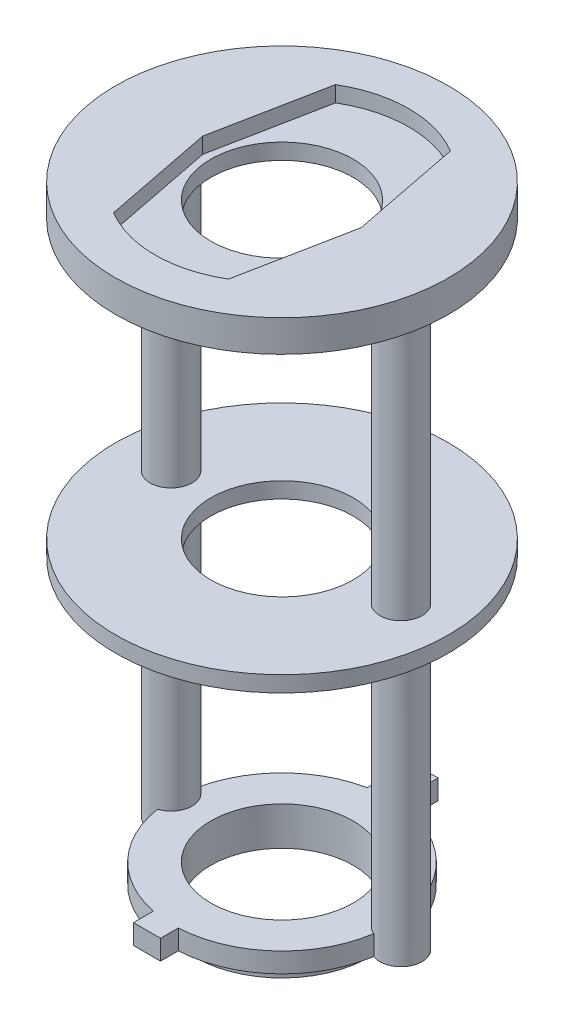
from build123d import *

# Parameters (mm, degrees)
BOSS_EXTRUDE1_DEPTH = 2.5
CUT_EXTRUDE1_REACH  = 26.645
SKETCH2_R           = 1.715
SKETCH2_R_2         = 8.98
SKETCH3_R           = 2.6543
BOSS_EXTRUDE2_DEPTH = 70.305
BOSS_EXTRUDE3_START = 4
SKETCH4_R           = 21
SKETCH4_R_2         = 8.98
BOSS_EXTRUDE3_DEPTH = 4
SKETCH6_R           = 21
SKETCH6_R_2         = 8.98
BOSS_EXTRUDE4_DEPTH = 2
CUT_EXTRUDE3_START  = -15
SKETCH7_R           = 1.715
CUT_EXTRUDE3_DEPTH  = 15
SKETCH8_R           = 8.98
CUT_EXTRUDE4_DEPTH  = 2
SKETCH9_R           = 11.0744
SKETCH9_R_2         = 8.98
BOSS_EXTRUDE5_DEPTH = 2.35


with BuildPart() as part:
    # Sketch1 → Boss-Extrude1 (new body)
    with BuildSketch(Plane(origin=(0, 0, 0), x_dir=(1, 0, 0), z_dir=(0, 1, 0))):
        with BuildLine():
            Line((0.597960958, 12.236443242), (0.597960958, 17.5133))
            Line((0.597960958, 17.5133), (-2.819411684, 17.5133))
            Line((-2.819411684, 17.5133), (-2.819411684, 11.976881697))
            ThreePointArc((-2.819411684, 11.976881697), (-9.752212861, 8.278991937), (-13.533031252, 1.391065316))
            ThreePointArc((-13.533031252, 1.391065316), (-17.156497956, -0.999626805), (-13.683409812, -3.603965207))
            ThreePointArc((-13.683409812, -3.603965207), (-10.042516815, -11.01106651), (-2.819411684, -15.004561697))
            Line((-2.819411684, -15.004561697), (-2.819411684, -17.5133))
            Line((-2.819411684, -17.5133), (0.597960958, -17.5133))
            Line((0.597960958, -17.5133), (0.597960958, -15.264123242))
            ThreePointArc((0.597960958, -15.264123242), (9.161591247, -11.721092084), (13.538839655, -3.55233882))
            ThreePointArc((13.538839655, -3.55233882), (17.156522938, -1.000460972), (13.393344487, 1.331534062))
            ThreePointArc((13.393344487, 1.331534062), (8.853545908, 8.96396608), (0.597960958, 12.236443242))
        make_face()
    extrude(amount=BOSS_EXTRUDE1_DEPTH)

    # Sketch2 → Cut-Extrude1 (cut, up to next)
    with BuildSketch(Plane(origin=(0, 2.5, 0), x_dir=(1, 0, 0), z_dir=(0, 1, 0)), mode=Mode.PRIVATE) as cut_extrude1_sk1:
        with Locations(Location((-14.5034, -1.0795, 0), (0, 0, 270))):
            Circle(SKETCH2_R)
    cut_extrude1_tool1 = extrude(cut_extrude1_sk1.sketch, amount=-CUT_EXTRUDE1_REACH, mode=Mode.PRIVATE) & part.part
    # Sketch2 → Cut-Extrude1 (cut, up to next)
    with BuildSketch(Plane(origin=(0, 2.5, 0), x_dir=(1, 0, 0), z_dir=(0, 1, 0)), mode=Mode.PRIVATE) as cut_extrude1_sk2:
        with Locations(Location((14.5034, -1.0795, 0), (0, 0, 270))):
            Circle(SKETCH2_R)
    cut_extrude1_tool2 = extrude(cut_extrude1_sk2.sketch, amount=-CUT_EXTRUDE1_REACH, mode=Mode.PRIVATE) & part.part
    # Sketch2 → Cut-Extrude1 (cut, up to next)
    with BuildSketch(Plane(origin=(0, 2.5, 0), x_dir=(1, 0, 0), z_dir=(0, 1, 0)), mode=Mode.PRIVATE) as cut_extrude1_sk3:
        with Locations(Location((-0.0762, -1.51384, 0), (0, 0, 270))):
            Circle(SKETCH2_R_2)
    cut_extrude1_tool3 = extrude(cut_extrude1_sk3.sketch, amount=-CUT_EXTRUDE1_REACH, mode=Mode.PRIVATE) & part.part
    add(cut_extrude1_tool1.solids().sort_by_distance((-14.5034, 2.5, 1.0795))[0], mode=Mode.SUBTRACT)
    add(cut_extrude1_tool2.solids().sort_by_distance((14.5034, 2.5, 1.0795))[0], mode=Mode.SUBTRACT)
    add(cut_extrude1_tool3.solids().sort_by_distance((-0.0762, 2.5, 1.51384))[0], mode=Mode.SUBTRACT)

    # Sketch3 → Boss-Extrude2 (add)
    with BuildSketch(Plane(origin=(0, 2.5, 0), x_dir=(1, 0, 0), z_dir=(0, 1, 0))):
        with Locations(Location((-14.5034, -1.0795, 0), (0, 0, 68.556492541))):
            Circle(SKETCH3_R)
        with Locations(Location((14.5034, -1.0795, 0), (0, 0, 114.72164566))):
            Circle(SKETCH3_R)
    extrude(amount=BOSS_EXTRUDE2_DEPTH)

    # Sketch4 → Boss-Extrude3 (add)
    with BuildSketch(Plane(origin=(0, 72.805, 0), x_dir=(1, 0, 0), z_dir=(0, 1, 0)).offset(BOSS_EXTRUDE3_START)):
        with Locations(Location((-0.0762, -1.51384, 0), (0, 0, 270))):
            Circle(SKETCH4_R)
        with Locations(Location((-0.0762, -1.51384, 0), (0, 0, 270))):
            Circle(SKETCH4_R_2, mode=Mode.SUBTRACT)
    extrude(amount=-BOSS_EXTRUDE3_DEPTH)

    # Sketch6 → Boss-Extrude4 (add)
    with BuildSketch(Plane(origin=(0, 37.805, 0), x_dir=(-1, 0, 0), z_dir=(0, -1, 0))):
        with Locations(Location((0.0762, -1.51384, 0), (0, 0, 90))):
            Circle(SKETCH6_R)
        with Locations(Location((0.0762, -1.51384, 0), (0, 0, 270))):
            Circle(SKETCH6_R_2, mode=Mode.SUBTRACT)
    extrude(amount=BOSS_EXTRUDE4_DEPTH)

    # Sketch7 → Cut-Extrude3 (cut)
    with BuildSketch(Plane.XZ.offset(CUT_EXTRUDE3_START)):
        with Locations(Location((-14.5034, 1.0795, 0), (0, 0, 90))):
            Circle(SKETCH7_R)
        with Locations(Location((14.5034, 1.0795, 0), (0, 0, 90))):
            Circle(SKETCH7_R)
    extrude(amount=CUT_EXTRUDE3_DEPTH, mode=Mode.SUBTRACT)

    # Sketch8 → Cut-Extrude4 (cut)
    with BuildSketch(Plane(origin=(0, 76.805, 0), x_dir=(1, 0, 0), z_dir=(0, 1, 0))):
        with BuildLine():
            Line((-10.0762, -1.51384), (-7.3262, -15.51384))
            ThreePointArc((-7.3262, -15.51384), (-0.0762, -17.51384), (7.1738, -15.51384))
            Line((7.1738, -15.51384), (9.9238, -1.51384))
            Line((9.9238, -1.51384), (7.1738, 12.48616))
            ThreePointArc((7.1738, 12.48616), (-0.0762, 14.48616), (-7.3262, 12.48616))
            Line((-7.3262, 12.48616), (-10.0762, -1.51384))
        make_face()
        with Locations(Location((-0.0762, -1.51384, 0), (0, 0, 270))):
            Circle(SKETCH8_R, mode=Mode.SUBTRACT)
    extrude(amount=-CUT_EXTRUDE4_DEPTH, mode=Mode.SUBTRACT)

    # Sketch9 → Boss-Extrude5 (add)
    with BuildSketch(Plane.XZ):
        with Locations(Location((-0.0762, 1.51384, 0), (0, 0, 90))):
            Circle(SKETCH9_R)
        with Locations(Location((-0.0762, 1.51384, 0), (0, 0, 90))):
            Circle(SKETCH9_R_2, mode=Mode.SUBTRACT)
    extrude(amount=BOSS_EXTRUDE5_DEPTH)


solid = part.part
